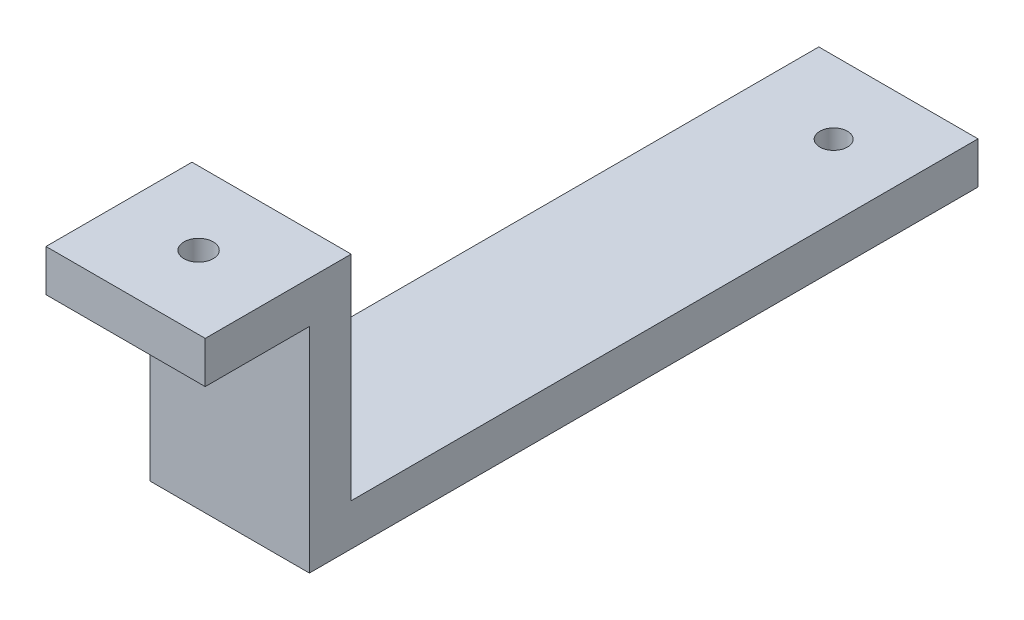
from build123d import *

# Parameters (mm, degrees)
EXTRUDE_THIN1_DEPTH = 38.1
SKETCH2_R           = 3.5
CUT_EXTRUDE1_DEPTH  = 199.45691472
SKETCH4_R           = 3.3
CUT_EXTRUDE3_DEPTH  = 60


with BuildPart() as part:
    # Sketch1 → Extrude-Thin1 (new body)
    with BuildSketch(Plane(origin=(0, 0, 0), x_dir=(0, 0, -1), z_dir=(1, 0, 0))):
        Polygon((0, 0), (34.93, 0), (34.93, -51.11), (184.93, -51.11), (184.93, -61.11), (24.93, -61.11), (24.93, -10), (0, -10), align=None)
    extrude(amount=EXTRUDE_THIN1_DEPTH)

    # Sketch2 → Cut-Extrude1 (cut, through all)
    with BuildSketch(Plane(origin=(0, 0, 0), x_dir=(1, 0, 0), z_dir=(0, 1, 0))):
        with Locations(Location((19.05, 17.465, 0), (0, 0, 270))):
            Circle(SKETCH2_R)
    extrude(amount=-CUT_EXTRUDE1_DEPTH, mode=Mode.SUBTRACT)

    # Sketch4 → Cut-Extrude3 (cut)
    with BuildSketch(Plane(origin=(0, -51.11, 0), x_dir=(1, 0, 0), z_dir=(0, 1, 0))):
        with Locations(Location((20.897590421, 167.59354, 0), (0, 0, 270))):
            Circle(SKETCH4_R)
    extrude(amount=-CUT_EXTRUDE3_DEPTH, mode=Mode.SUBTRACT)


solid = part.part
